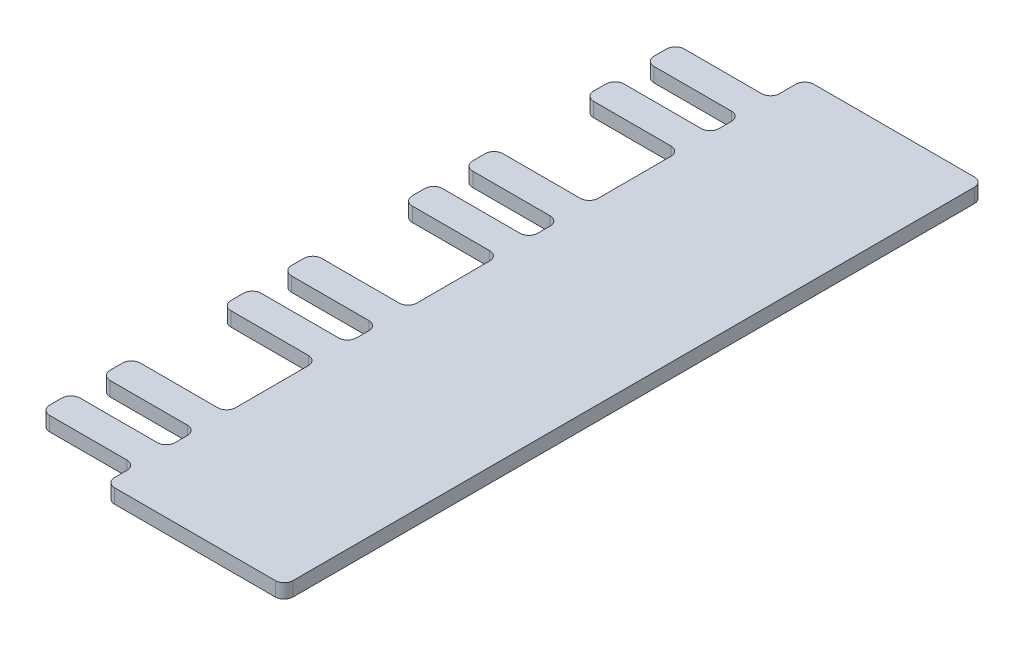
from build123d import *

# Parameters (mm, degrees)
BOSS_EXTRUDE1_DEPTH = 1.2


with BuildPart() as part:
    # Sketch1 → Boss-Extrude1 (new body)
    with BuildSketch(Plane(origin=(0, 0, 0), x_dir=(1, 0, 0), z_dir=(0, 1, 0))):
        with BuildLine():
            Line((-0.75, 2.54), (-7.25, 2.54))
            ThreePointArc((-7.25, 2.54), (-7.780330086, 2.759669914), (-8, 3.29))
            Line((-8, 3.29), (-8, 4.33))
            ThreePointArc((-8, 4.33), (-7.780330086, 4.860330086), (-7.25, 5.08))
            Line((-7.25, 5.08), (-0.75, 5.08))
            ThreePointArc((-0.75, 5.08), (-0.219669914, 5.299669914), (0, 5.83))
            Line((0, 5.83), (0, 6.87))
            ThreePointArc((0, 6.87), (-0.219669914, 7.400330086), (-0.75, 7.62))
            Line((-0.75, 7.62), (-7.25, 7.62))
            ThreePointArc((-7.25, 7.62), (-7.780330086, 7.839669914), (-8, 8.37))
            Line((-8, 8.37), (-8, 9.41))
            ThreePointArc((-8, 9.41), (-7.780330086, 9.940330086), (-7.25, 10.16))
            Line((-7.25, 10.16), (-0.75, 10.16))
            ThreePointArc((-0.75, 10.16), (-0.219669914, 10.379669914), (0, 10.91))
            Line((0, 10.91), (0, 17.03))
            ThreePointArc((0, 17.03), (-0.219669914, 17.560330086), (-0.75, 17.78))
            Line((-0.75, 17.78), (-7.25, 17.78))
            ThreePointArc((-7.25, 17.78), (-7.780330086, 17.999669914), (-8, 18.53))
            Line((-8, 18.53), (-8, 19.57))
            ThreePointArc((-8, 19.57), (-7.780330086, 20.100330086), (-7.25, 20.32))
            Line((-7.25, 20.32), (-0.75, 20.32))
            ThreePointArc((-0.75, 20.32), (-0.219669914, 20.539669914), (0, 21.07))
            Line((0, 21.07), (0, 22.11))
            ThreePointArc((0, 22.11), (-0.219669914, 22.640330086), (-0.75, 22.86))
            Line((-0.75, 22.86), (-7.25, 22.86))
            ThreePointArc((-7.25, 22.86), (-7.780330086, 23.079669914), (-8, 23.61))
            Line((-8, 23.61), (-8, 24.65))
            ThreePointArc((-8, 24.65), (-7.780330086, 25.180330086), (-7.25, 25.4))
            Line((-7.25, 25.4), (-0.75, 25.4))
            ThreePointArc((-0.75, 25.4), (-0.219669914, 25.619669914), (0, 26.15))
            Line((0, 26.15), (0, 32.27))
            ThreePointArc((0, 32.27), (-0.219669914, 32.800330086), (-0.75, 33.02))
            Line((-0.75, 33.02), (-7.25, 33.02))
            ThreePointArc((-7.25, 33.02), (-7.780330086, 33.239669914), (-8, 33.77))
            Line((-8, 33.77), (-8, 34.81))
            ThreePointArc((-8, 34.81), (-7.780330086, 35.340330086), (-7.25, 35.56))
            Line((-7.25, 35.56), (-0.75, 35.56))
            ThreePointArc((-0.75, 35.56), (-0.219669914, 35.779669914), (0, 36.31))
            Line((0, 36.31), (0, 37.35))
            ThreePointArc((0, 37.35), (-0.219669914, 37.880330086), (-0.75, 38.1))
            Line((-0.75, 38.1), (-7.25, 38.1))
            ThreePointArc((-7.25, 38.1), (-7.780330086, 38.319669914), (-8, 38.85))
            Line((-8, 38.85), (-8, 39.89))
            ThreePointArc((-8, 39.89), (-7.780330086, 40.420330086), (-7.25, 40.64))
            Line((-7.25, 40.64), (-0.75, 40.64))
            ThreePointArc((-0.75, 40.64), (-0.219669914, 40.859669914), (0, 41.39))
            Line((0, 41.39), (0, 47.51))
            ThreePointArc((0, 47.51), (-0.219669914, 48.040330086), (-0.75, 48.26))
            Line((-0.75, 48.26), (-7.25, 48.26))
            ThreePointArc((-7.25, 48.26), (-7.780330086, 48.479669914), (-8, 49.01))
            Line((-8, 49.01), (-8, 50.05))
            ThreePointArc((-8, 50.05), (-7.780330086, 50.580330086), (-7.25, 50.8))
            Line((-7.25, 50.8), (-0.75, 50.8))
            ThreePointArc((-0.75, 50.8), (-0.219669914, 51.019669914), (0, 51.55))
            Line((0, 51.55), (0, 52.59))
            ThreePointArc((0, 52.59), (-0.219669914, 53.120330086), (-0.75, 53.34))
            Line((-0.75, 53.34), (-7.25, 53.34))
            ThreePointArc((-7.25, 53.34), (-7.780330086, 53.559669914), (-8, 54.09))
            Line((-8, 54.09), (-8, 55.13))
            ThreePointArc((-8, 55.13), (-7.780330086, 55.660330086), (-7.25, 55.88))
            Line((-7.25, 55.88), (-0.75, 55.88))
            ThreePointArc((-0.75, 55.88), (-0.219669914, 56.099669914), (0, 56.63))
            Line((0, 56.63), (0, 58.006821116))
            ThreePointArc((0, 58.006821116), (0.219669914, 58.537151202), (0.75, 58.756821116))
            Line((0.75, 58.756821116), (14.25, 58.756821116))
            ThreePointArc((14.25, 58.756821116), (14.780330086, 58.537151202), (15, 58.006821116))
            Line((15, 58.006821116), (15, 0.75))
            ThreePointArc((15, 0.75), (14.780330086, 0.219669914), (14.25, 0))
            Line((14.25, 0), (0.75, 0))
            ThreePointArc((0.75, 0), (0.219669914, 0.219669914), (0, 0.75))
            Line((0, 0.75), (0, 1.79))
            ThreePointArc((0, 1.79), (-0.219669914, 2.320330086), (-0.75, 2.54))
        make_face()
    extrude(amount=BOSS_EXTRUDE1_DEPTH)


solid = part.part
